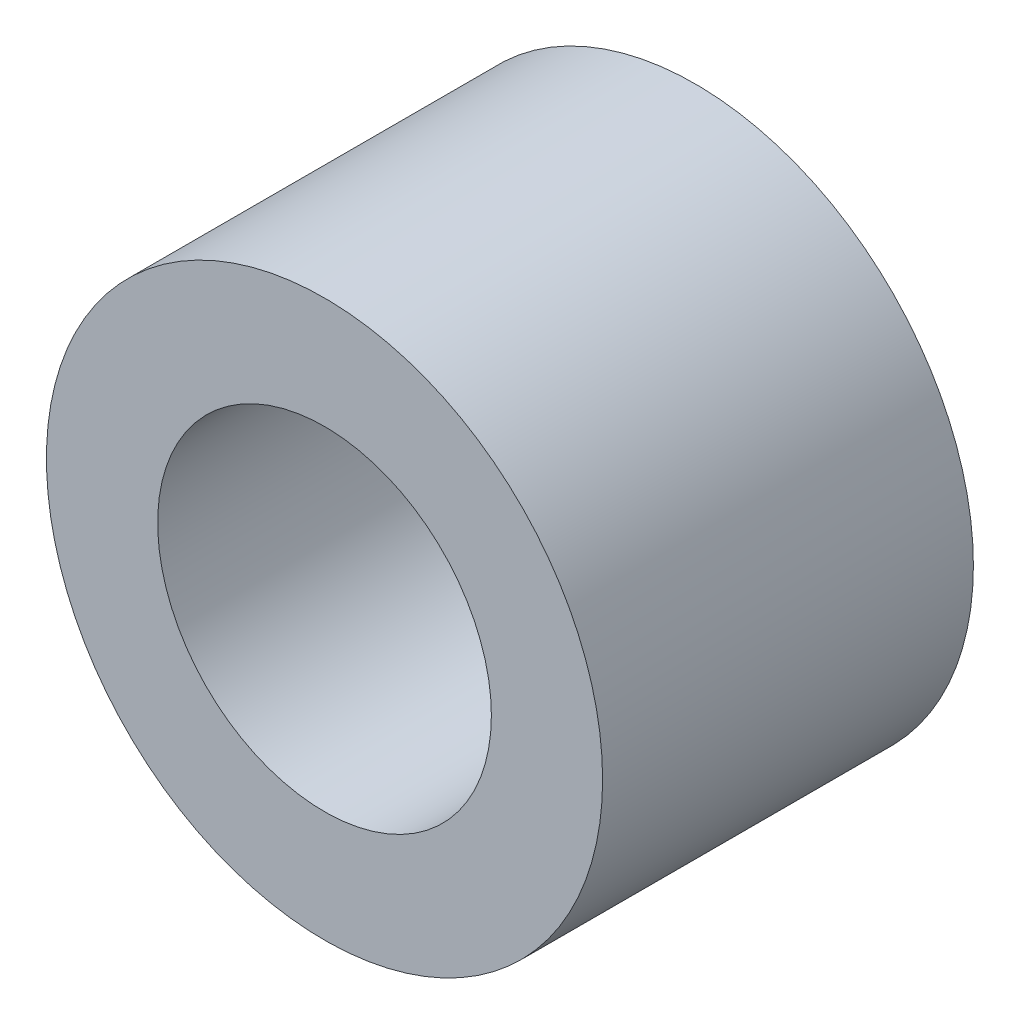
from build123d import *

# Parameters (mm, degrees)
SKETCH1_R           = 7.5
SKETCH1_R_2         = 4.5
BOSS_EXTRUDE1_DEPTH = 10


with BuildPart() as part:
    # Sketch1 → Boss-Extrude1 (new body)
    with BuildSketch(Plane.XY):
        Circle(SKETCH1_R)
        Circle(SKETCH1_R_2, mode=Mode.SUBTRACT)
    extrude(amount=BOSS_EXTRUDE1_DEPTH)


solid = part.part
